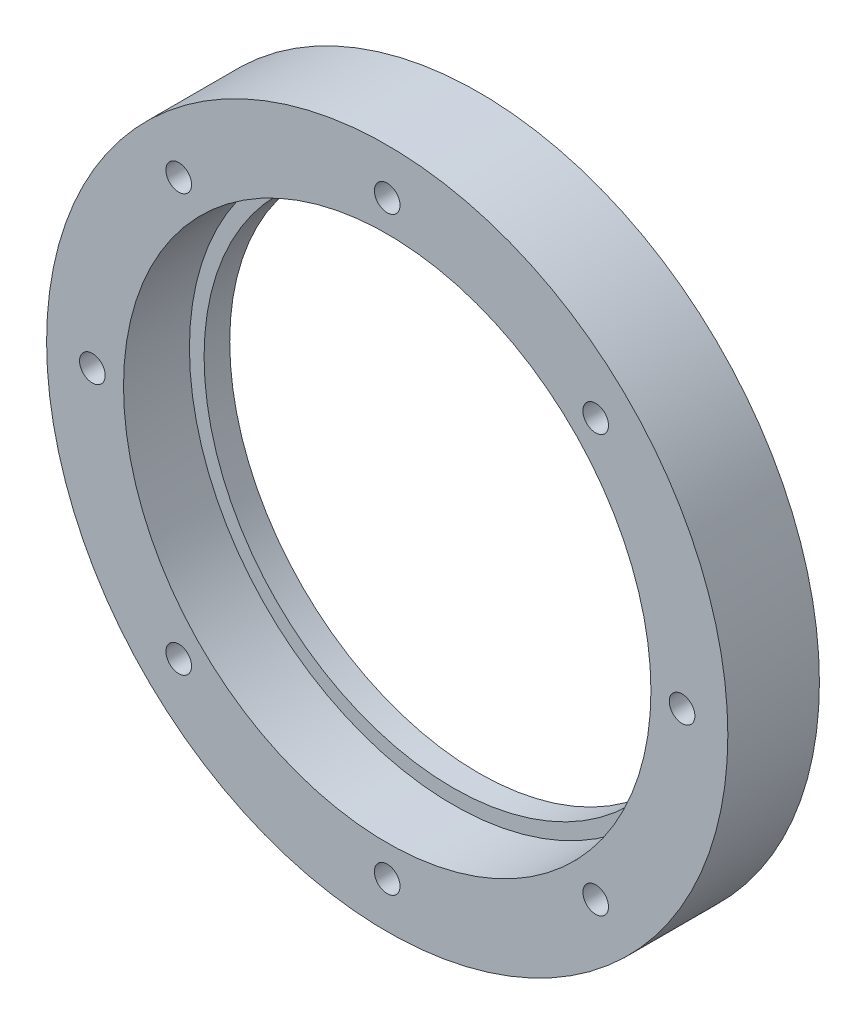
from build123d import *

# Parameters (mm, degrees)
SKETCH1_R           = 46.5
SKETCH1_R_2         = 36
BOSS_EXTRUDE1_DEPTH = 6.25
SKETCH4_R           = 36
SKETCH4_R_2         = 34
BOSS_EXTRUDE2_DEPTH = 3.5
SKETCH3_R           = 1.75
CUT_EXTRUDE1_DEPTH  = 67.938404522
CIRPATTERN1_COUNT   = 8


with BuildPart() as part:
    # Sketch1 → Boss-Extrude1 (new, symmetric)
    with BuildSketch(Plane.XY):
        Circle(SKETCH1_R)
        Circle(SKETCH1_R_2, mode=Mode.SUBTRACT)
    extrude(amount=BOSS_EXTRUDE1_DEPTH, both=True)

    # Sketch4 → Boss-Extrude2 (add)
    with BuildSketch(Plane.XY.offset(-6.25)):
        Circle(SKETCH4_R)
        Circle(SKETCH4_R_2, mode=Mode.SUBTRACT)
    extrude(amount=BOSS_EXTRUDE2_DEPTH)

    # Sketch3 → Cut-Extrude1 (cut, through all)
    with BuildSketch(Plane.XY.offset(6.25)):
        with Locations((0, 40.25)):
            Circle(SKETCH3_R)
    cut_extrude1 = extrude(amount=-CUT_EXTRUDE1_DEPTH, mode=Mode.SUBTRACT)

    # CirPattern1: Cut-Extrude1 ×8 about axis
    cirpattern1_axis = Axis((0, 0, 0), (0, 0, 1))
    for i in range(1, CIRPATTERN1_COUNT):
        add(cut_extrude1.rotate(cirpattern1_axis, i * 360 / CIRPATTERN1_COUNT), mode=Mode.SUBTRACT)


solid = part.part
